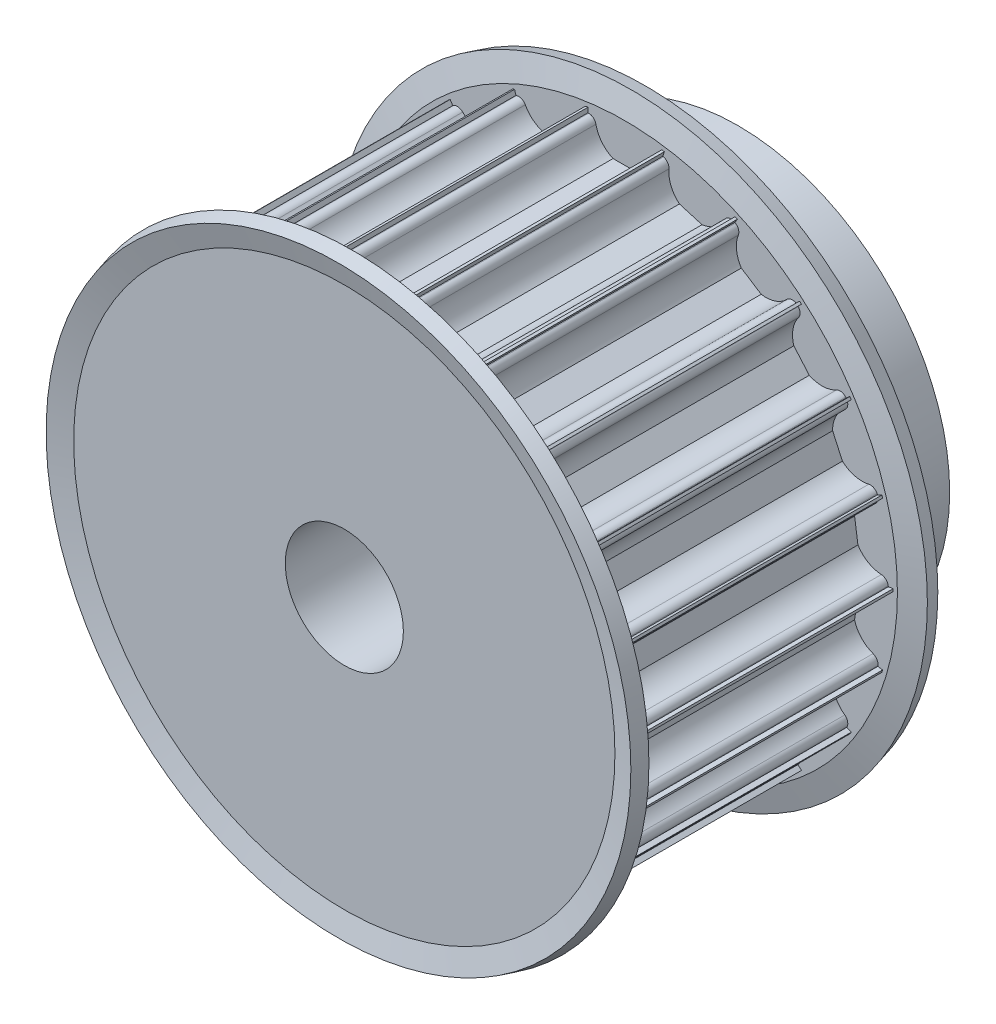
from build123d import *

# Parameters (mm, degrees)
CUT_EXTRUDE1_DEPTH = 56.543901555
CIRPATTERN1_COUNT  = 22


with BuildPart() as part:
    # Sketch1 → Revolve2 (revolve)
    with BuildSketch(Plane(origin=(0, 0, 0), x_dir=(0, 0, -1), z_dir=(1, 0, 0)), mode=Mode.PRIVATE) as revolve2_sk:
        Polygon((30, 27.25), (0, 27.25), (0, 6), (40, 6), (40, 21.5), (30, 21.5), align=None)
    revolve(revolve2_sk.sketch.rotate(Axis((0, 0, 0), (0, 0, -1)), 90), axis=Axis((0, 0, 0), (0, 0, -1)))

    # Sketch2 → Cut-Extrude1 (cut, symmetric)
    with BuildSketch(Plane.XY):
        with BuildLine():
            Line((-3.674234614, 26.5), (-3.75, 26.5))
            Line((-3.75, 26.5), (-3.75, 28.5))
            Line((-3.75, 28.5), (3.75, 28.5))
            Line((3.75, 28.5), (3.75, 26.5))
            Line((3.75, 26.5), (3.674234614, 26.5))
            ThreePointArc((3.674234614, 26.5), (3.199892965, 26.330947502), (2.939387691, 25.9))
            ThreePointArc((2.939387691, 25.9), (2.331759211, 24.612435701), (1.198957881, 23.75))
            Line((1.198957881, 23.75), (-1.198957881, 23.75))
            ThreePointArc((-1.198957881, 23.75), (-2.331759211, 24.612435701), (-2.939387691, 25.9))
            ThreePointArc((-2.939387691, 25.9), (-3.199892965, 26.330947502), (-3.674234614, 26.5))
        make_face()
    cut_extrude1 = extrude(amount=CUT_EXTRUDE1_DEPTH, both=True, mode=Mode.SUBTRACT)

    # CirPattern1: Cut-Extrude1 ×22 about axis
    cirpattern1_axis = Axis((0, 0, 0), (0, 0, 1))
    for i in range(1, CIRPATTERN1_COUNT):
        add(cut_extrude1.rotate(cirpattern1_axis, i * 360 / CIRPATTERN1_COUNT), mode=Mode.SUBTRACT)

    # Sketch3 → Revolve3 (revolve)
    with BuildSketch(Plane(origin=(0, 0, 0), x_dir=(0, 0, -1), z_dir=(1, 0, 0)), mode=Mode.PRIVATE) as revolve3_sk:
        Polygon((30, 21.5), (30, 27.492521254), (30.591966801, 29.701771432), (29.143078062, 30.09), (28.5, 27.69), (28.5, 21.5), align=None)
        Polygon((1.5, 27.69), (1.5, 21.5), (0, 21.5), (0, 27.492521254), (-0.591966801, 29.701771432), (0.856921938, 30.09), align=None)
    revolve(revolve3_sk.sketch.rotate(Axis((0, 0, 0), (0, 0, -1)), 90), axis=Axis((0, 0, 0), (0, 0, -1)))


solid = part.part
